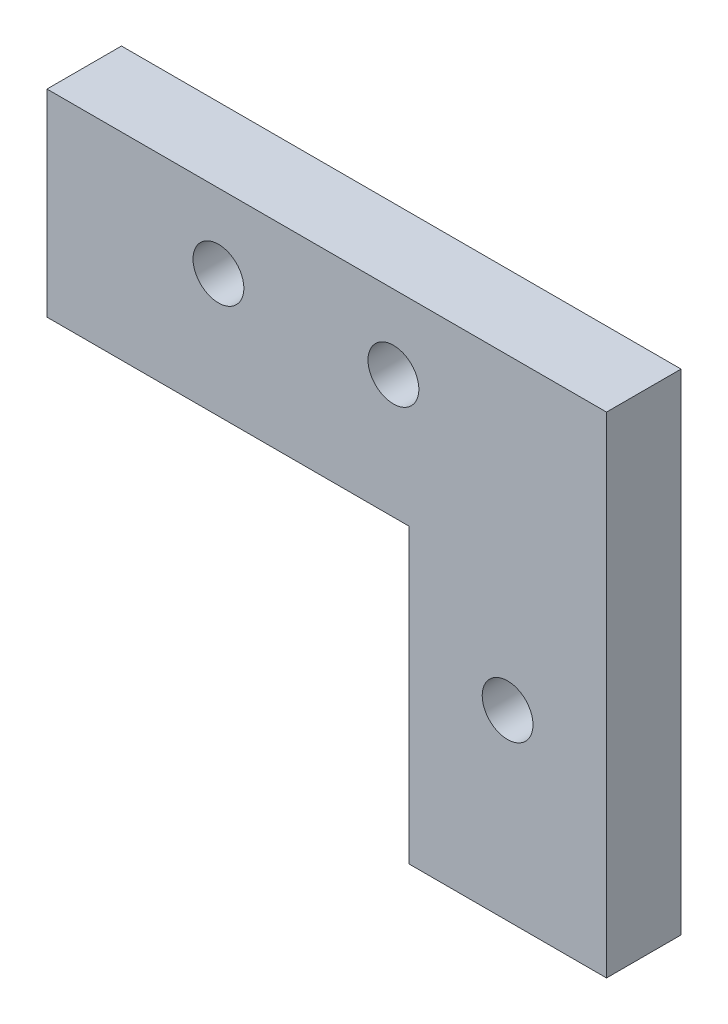
from build123d import *

# Parameters (mm, degrees)
BOSS_EXTRUDE1_DEPTH            = 42.65
SKETCH2_R                      = 6.425
CUT_EXTRUDE1_DEPTH             = 42.65
SKETCH3_W                      = 1.9
SKETCH3_H                      = 30
CUT_EXTRUDE2_DEPTH             = 42.65
SKETCH4_R                      = 6.425
CUT_EXTRUDE3_DEPTH             = 42.65
SKETCH5_W                      = 32
SKETCH5_H                      = 1.9
CUT_EXTRUDE4_DEPTH             = 42.65
M3_CLEARANCE_HOLE1_D           = 3.6
M3_CLEARANCE_HOLE1_DEPTH       = 10
M3_CLEARANCE_HOLE1_CSINK_D     = 3.65
M3_CLEARANCE_HOLE1_CSINK_ANGLE = 90
M3_CLEARANCE_HOLE1_TIP         = 1.081549114
SKETCH9_W                      = 61.993652624
SKETCH9_H                      = 40.55348858
CUT_EXTRUDE5_DEPTH             = 61.688696641


with BuildPart() as part:
    # Sketch1 → Boss-Extrude1 (new body)
    with BuildSketch(Plane.XY):
        Polygon((14, 0), (-25.65, 0), (-25.65, -14), (0, -14), (0, -34.73), (14, -34.73), align=None)
    extrude(amount=BOSS_EXTRUDE1_DEPTH)

    # Sketch2 → Cut-Extrude1 (cut)
    with BuildSketch(Plane.XZ.offset(14)):
        with Locations((-14.665, 27.725)):
            Circle(SKETCH2_R)
    extrude(amount=-CUT_EXTRUDE1_DEPTH, mode=Mode.SUBTRACT)

    # Sketch3 → Cut-Extrude2 (cut)
    with BuildSketch(Plane.XZ.offset(14)):
        with Locations((-16.7, 27.65)):
            Rectangle(SKETCH3_W, SKETCH3_H)
    extrude(amount=-CUT_EXTRUDE2_DEPTH, mode=Mode.SUBTRACT)

    # Sketch4 → Cut-Extrude3 (cut)
    with BuildSketch(Plane.ZY):
        with Locations((18.725, -21.745)):
            Circle(SKETCH4_R)
    extrude(amount=-CUT_EXTRUDE3_DEPTH, mode=Mode.SUBTRACT)

    # Sketch5 → Cut-Extrude4 (cut)
    with BuildSketch(Plane.ZY):
        with Locations((26.65, -25.78)):
            Rectangle(SKETCH5_W, SKETCH5_H)
    extrude(amount=-CUT_EXTRUDE4_DEPTH, mode=Mode.SUBTRACT)

    # M3 Clearance Hole1
    with Locations(Plane(origin=(0, 0, 0), x_dir=(-1, 0, 0), z_dir=(0, 0, -1))):
        with Locations((1.1, -5.25), (13.5, -5.25), (-6.99, -21.8)):
            CounterSinkHole(M3_CLEARANCE_HOLE1_D / 2, M3_CLEARANCE_HOLE1_CSINK_D / 2, depth=M3_CLEARANCE_HOLE1_DEPTH, counter_sink_angle=M3_CLEARANCE_HOLE1_CSINK_ANGLE)
            with Locations((0, 0, -(M3_CLEARANCE_HOLE1_DEPTH + M3_CLEARANCE_HOLE1_TIP / 2))):  # 118° drill point
                Cone(0, M3_CLEARANCE_HOLE1_D / 2, M3_CLEARANCE_HOLE1_TIP, mode=Mode.SUBTRACT)

    # Sketch9 → Cut-Extrude5 (cut, through all)
    with BuildSketch(Plane(origin=(0, 0, 0), x_dir=(1, 0, 0), z_dir=(0, 1, 0))):
        with Locations((-5.42180131, -25.55674429)):
            Rectangle(SKETCH9_W, SKETCH9_H)
    extrude(amount=-CUT_EXTRUDE5_DEPTH, mode=Mode.SUBTRACT)


solid = part.part
